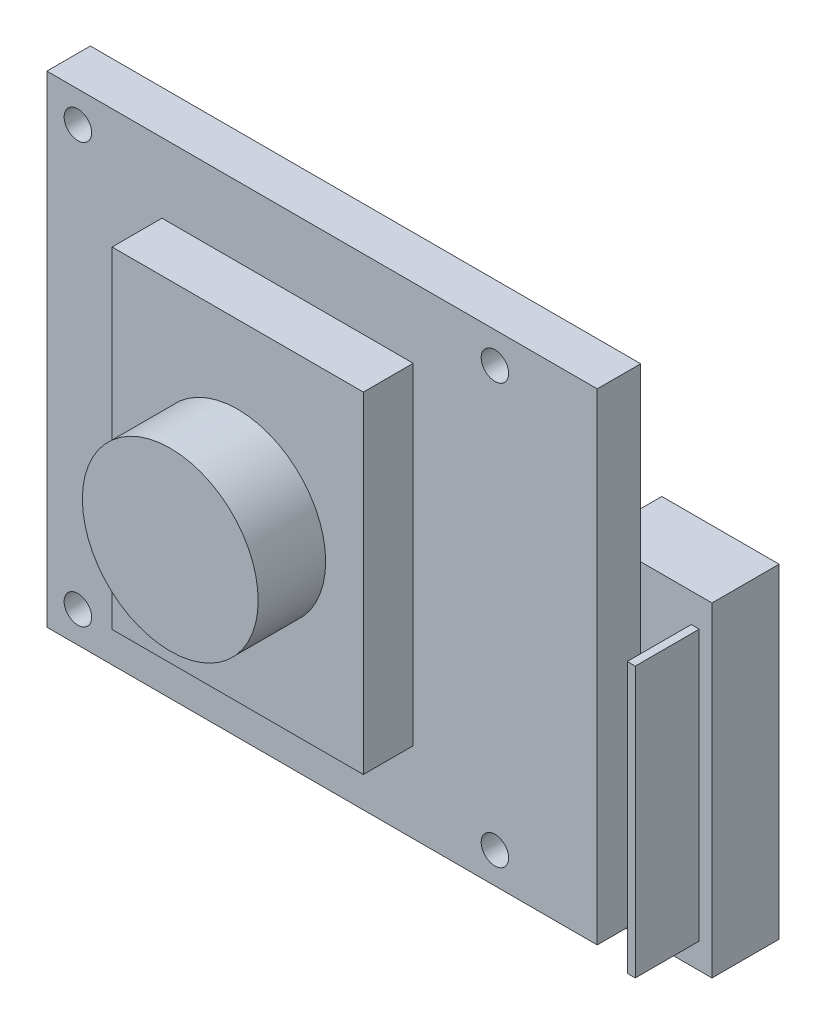
from build123d import *

# Parameters (mm, degrees)
SKETCH1_W           = 43.7261
SKETCH1_H           = 38.2651
BOSS_EXTRUDE1_DEPTH = 3.4544
SKETCH2_W           = 9.3218
SKETCH2_H           = 25.8064
BOSS_EXTRUDE2_DEPTH = 5.334
SKETCH3_W           = 0.635
SKETCH3_H           = 21.463
BOSS_EXTRUDE3_DEPTH = 5.08
SKETCH4_R           = 1.0922
CUT_EXTRUDE1_DEPTH  = 5.08
SKETCH5_W           = 19.9644
SKETCH5_H           = 26.3144
BOSS_EXTRUDE4_DEPTH = 3.9624
SKETCH6_R           = 6.985
BOSS_EXTRUDE5_DEPTH = 6.5024
SKETCH7_R           = 1.524
BOSS_EXTRUDE6_DEPTH = 3.6195


with BuildPart() as part:
    # Sketch1 → Boss-Extrude1 (new body)
    with BuildSketch(Plane.XY):
        with Locations((-21.86305, 19.13255)):
            Rectangle(SKETCH1_W, SKETCH1_H)
    extrude(amount=BOSS_EXTRUDE1_DEPTH)

    # Sketch2 → Boss-Extrude2 (add)
    with BuildSketch(Plane(origin=(0, 0, 0), x_dir=(-1, 0, 0), z_dir=(0, 0, -1))):
        with Locations((-1.0033, 11.7348)):
            Rectangle(SKETCH2_W, SKETCH2_H)
    extrude(amount=BOSS_EXTRUDE2_DEPTH)

    # Sketch3 → Boss-Extrude3 (add)
    with BuildSketch(Plane.XY):
        with Locations((4.3307, 11.5951)):
            Rectangle(SKETCH3_W, SKETCH3_H)
    extrude(amount=BOSS_EXTRUDE3_DEPTH)

    # Sketch4 → Cut-Extrude1 (cut)
    with BuildSketch(Plane(origin=(0, 0, 0), x_dir=(-1, 0, 0), z_dir=(0, 0, -1))):
        with Locations((41.2623, 35.8013)):
            Circle(SKETCH4_R)
        with Locations((41.2623, 2.4638)):
            Circle(SKETCH4_R)
        with Locations((8.128, 2.4638)):
            Circle(SKETCH4_R)
        with Locations((8.128, 35.8013)):
            Circle(SKETCH4_R)
    extrude(amount=-CUT_EXTRUDE1_DEPTH, mode=Mode.SUBTRACT)

    # Sketch5 → Boss-Extrude4 (add)
    with BuildSketch(Plane.XY.offset(3.4544)):
        with Locations((-24.5999, 19.558)):
            Rectangle(SKETCH5_W, SKETCH5_H)
    extrude(amount=BOSS_EXTRUDE4_DEPTH)

    # Sketch6 → Boss-Extrude5 (add)
    with BuildSketch(Plane(origin=(0, 0, 12.7762), x_dir=(-1, 0, 0), z_dir=(0, 0, -1))):
        with Locations((24.5999, 19.558)):
            Circle(SKETCH6_R)
    extrude(amount=BOSS_EXTRUDE5_DEPTH)

    # Sketch7 → Boss-Extrude6 (add)
    with BuildSketch(Plane(origin=(0, 0, 0), x_dir=(-1, 0, 0), z_dir=(0, 0, -1))):
        with Locations((25.4381, 30.0482)):
            Circle(SKETCH7_R)
        with Locations((25.4381, 8.128)):
            Circle(SKETCH7_R)
    extrude(amount=BOSS_EXTRUDE6_DEPTH)


solid = part.part
